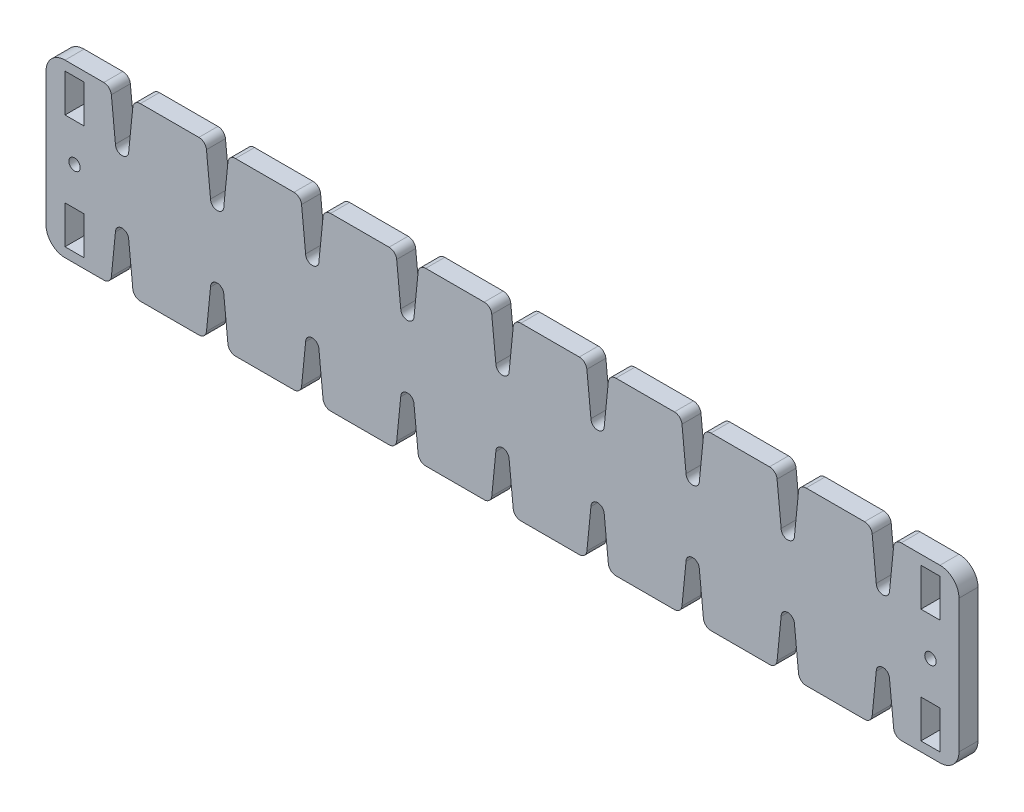
from build123d import *

# Parameters (mm, degrees)
SKETCH1_W           = 240
SKETCH1_H           = 45
SKETCH1_R           = 1.5
SKETCH1_W_2         = 5
SKETCH1_H_2         = 10
BOSS_EXTRUDE1_DEPTH = 5
CUT_EXTRUDE1_DEPTH  = 5
FILLET1_R           = 2
CONG_1_R            = 5


with BuildPart() as part:
    # Sketch1 → Boss-Extrude1 (new body)
    with BuildSketch(Plane.XY):
        with Locations((34.186746988, 0)):
            Rectangle(SKETCH1_W, SKETCH1_H)
        with Locations((-78.313253012, 0)):
            Circle(SKETCH1_R, mode=Mode.SUBTRACT)
        with Locations(Location((146.686746988, 0, 0), (0, 0, 180))):
            Circle(SKETCH1_R, mode=Mode.SUBTRACT)
        with Locations((-78.313253012, -15)):
            Rectangle(SKETCH1_W_2, SKETCH1_H_2, mode=Mode.SUBTRACT)
        with Locations((-78.313253012, 15)):
            Rectangle(SKETCH1_W_2, SKETCH1_H_2, mode=Mode.SUBTRACT)
        with Locations((146.686746988, -15)):
            Rectangle(SKETCH1_W_2, SKETCH1_H_2, mode=Mode.SUBTRACT)
        with Locations((146.686746988, 15)):
            Rectangle(SKETCH1_W_2, SKETCH1_H_2, mode=Mode.SUBTRACT)
    extrude(amount=BOSS_EXTRUDE1_DEPTH)

    # Sketch2 → Cut-Extrude1 (cut)
    with BuildSketch(Plane.XY.offset(5)):
        with BuildLine():
            Line((-68.813253012, 22.5), (-62.813253012, 22.5))
            Line((-62.813253012, 22.5), (-64.063253012, 10))
            ThreePointArc((-64.063253012, 10), (-65.813253012, 8.25), (-67.563253012, 10))
            Line((-67.563253012, 10), (-68.813253012, 22.5))
        make_face()
        with BuildLine():
            Line((-43.813253012, 22.5), (-37.813253012, 22.5))
            Line((-37.813253012, 22.5), (-39.063253012, 10))
            ThreePointArc((-39.063253012, 10), (-40.813253012, 8.25), (-42.563253012, 10))
            Line((-42.563253012, 10), (-43.813253012, 22.5))
        make_face()
        with BuildLine():
            Line((-18.813253012, 22.5), (-12.813253012, 22.5))
            Line((-12.813253012, 22.5), (-14.063253012, 10))
            ThreePointArc((-14.063253012, 10), (-15.813253012, 8.25), (-17.563253012, 10))
            Line((-17.563253012, 10), (-18.813253012, 22.5))
        make_face()
        with BuildLine():
            Line((6.186746988, 22.5), (12.186746988, 22.5))
            Line((12.186746988, 22.5), (10.936746988, 10))
            ThreePointArc((10.936746988, 10), (9.186746988, 8.25), (7.436746988, 10))
            Line((7.436746988, 10), (6.186746988, 22.5))
        make_face()
        with BuildLine():
            Line((31.186746988, 22.5), (37.186746988, 22.5))
            Line((37.186746988, 22.5), (35.936746988, 10))
            ThreePointArc((35.936746988, 10), (34.186746988, 8.25), (32.436746988, 10))
            Line((32.436746988, 10), (31.186746988, 22.5))
        make_face()
        with BuildLine():
            Line((56.186746988, 22.5), (62.186746988, 22.5))
            Line((62.186746988, 22.5), (60.936746988, 10))
            ThreePointArc((60.936746988, 10), (59.186746988, 8.25), (57.436746988, 10))
            Line((57.436746988, 10), (56.186746988, 22.5))
        make_face()
        with BuildLine():
            Line((81.186746988, 22.5), (87.186746988, 22.5))
            Line((87.186746988, 22.5), (85.936746988, 10))
            ThreePointArc((85.936746988, 10), (84.186746988, 8.25), (82.436746988, 10))
            Line((82.436746988, 10), (81.186746988, 22.5))
        make_face()
        with BuildLine():
            Line((106.186746988, 22.5), (112.186746988, 22.5))
            Line((112.186746988, 22.5), (110.936746988, 10))
            ThreePointArc((110.936746988, 10), (109.186746988, 8.25), (107.436746988, 10))
            Line((107.436746988, 10), (106.186746988, 22.5))
        make_face()
        with BuildLine():
            Line((131.186746988, 22.5), (137.186746988, 22.5))
            Line((137.186746988, 22.5), (135.936746988, 10))
            ThreePointArc((135.936746988, 10), (134.186746988, 8.25), (132.436746988, 10))
            Line((132.436746988, 10), (131.186746988, 22.5))
        make_face()
        with BuildLine():
            Line((137.186746988, -22.5), (135.936746988, -10))
            ThreePointArc((135.936746988, -10), (134.186746988, -8.25), (132.436746988, -10))
            Line((132.436746988, -10), (131.186746988, -22.5))
            Line((131.186746988, -22.5), (137.186746988, -22.5))
        make_face()
        with BuildLine():
            Line((112.186746988, -22.5), (110.936746988, -10))
            ThreePointArc((110.936746988, -10), (109.186746988, -8.25), (107.436746988, -10))
            Line((107.436746988, -10), (106.186746988, -22.5))
            Line((106.186746988, -22.5), (112.186746988, -22.5))
        make_face()
        with BuildLine():
            Line((87.186746988, -22.5), (85.936746988, -10))
            ThreePointArc((85.936746988, -10), (84.186746988, -8.25), (82.436746988, -10))
            Line((82.436746988, -10), (81.186746988, -22.5))
            Line((81.186746988, -22.5), (87.186746988, -22.5))
        make_face()
        with BuildLine():
            Line((62.186746988, -22.5), (60.936746988, -10))
            ThreePointArc((60.936746988, -10), (59.186746988, -8.25), (57.436746988, -10))
            Line((57.436746988, -10), (56.186746988, -22.5))
            Line((56.186746988, -22.5), (62.186746988, -22.5))
        make_face()
        with BuildLine():
            Line((37.186746988, -22.5), (35.936746988, -10))
            ThreePointArc((35.936746988, -10), (34.186746988, -8.25), (32.436746988, -10))
            Line((32.436746988, -10), (31.186746988, -22.5))
            Line((31.186746988, -22.5), (37.186746988, -22.5))
        make_face()
        with BuildLine():
            Line((12.186746988, -22.5), (10.936746988, -10))
            ThreePointArc((10.936746988, -10), (9.186746988, -8.25), (7.436746988, -10))
            Line((7.436746988, -10), (6.186746988, -22.5))
            Line((6.186746988, -22.5), (12.186746988, -22.5))
        make_face()
        with BuildLine():
            Line((-12.813253012, -22.5), (-14.063253012, -10))
            ThreePointArc((-14.063253012, -10), (-15.813253012, -8.25), (-17.563253012, -10))
            Line((-17.563253012, -10), (-18.813253012, -22.5))
            Line((-18.813253012, -22.5), (-12.813253012, -22.5))
        make_face()
        with BuildLine():
            Line((-37.813253012, -22.5), (-39.063253012, -10))
            ThreePointArc((-39.063253012, -10), (-40.813253012, -8.25), (-42.563253012, -10))
            Line((-42.563253012, -10), (-43.813253012, -22.5))
            Line((-43.813253012, -22.5), (-37.813253012, -22.5))
        make_face()
        with BuildLine():
            Line((-62.813253012, -22.5), (-64.063253012, -10))
            ThreePointArc((-64.063253012, -10), (-65.813253012, -8.25), (-67.563253012, -10))
            Line((-67.563253012, -10), (-68.813253012, -22.5))
            Line((-68.813253012, -22.5), (-62.813253012, -22.5))
        make_face()
    extrude(amount=-CUT_EXTRUDE1_DEPTH, mode=Mode.SUBTRACT)

    # Fillet1
    fillet1_edges = [part.edges().sort_by_distance(p)[0] for p in [
        (-62.813253012, -22.5, 2.5),
        (-68.813253012, -22.5, 2.5),
        (-37.813253012, -22.5, 2.5),
        (-43.813253012, -22.5, 2.5),
        (-12.813253012, -22.5, 2.5),
        (-18.813253012, -22.5, 2.5),
        (12.186746988, -22.5, 2.5),
        (6.186746988, -22.5, 2.5),
        (37.186746988, -22.5, 2.5),
        (31.186746988, -22.5, 2.5),
        (62.186746988, -22.5, 2.5),
        (56.186746988, -22.5, 2.5),
        (87.186746988, -22.5, 2.5),
        (81.186746988, -22.5, 2.5),
        (112.186746988, -22.5, 2.5),
        (106.186746988, -22.5, 2.5),
        (137.186746988, -22.5, 2.5),
        (131.186746988, -22.5, 2.5),
        (131.186746988, 22.5, 2.5),
        (137.186746988, 22.5, 2.5),
        (106.186746988, 22.5, 2.5),
        (112.186746988, 22.5, 2.5),
        (81.186746988, 22.5, 2.5),
        (87.186746988, 22.5, 2.5),
        (56.186746988, 22.5, 2.5),
        (62.186746988, 22.5, 2.5),
        (31.186746988, 22.5, 2.5),
        (37.186746988, 22.5, 2.5),
        (6.186746988, 22.5, 2.5),
        (12.186746988, 22.5, 2.5),
        (-18.813253012, 22.5, 2.5),
        (-12.813253012, 22.5, 2.5),
        (-43.813253012, 22.5, 2.5),
        (-37.813253012, 22.5, 2.5),
        (-68.813253012, 22.5, 2.5),
        (-62.813253012, 22.5, 2.5),
    ]]
    fillet(fillet1_edges, radius=FILLET1_R)

    # Congé1
    cong_1_edges = [part.edges().sort_by_distance(p)[0] for p in [
        (-85.813253012, 22.5, 2.5),
        (154.186746988, 22.5, 2.5),
        (154.186746988, -22.5, 2.5),
        (-85.813253012, -22.5, 2.5),
    ]]
    fillet(cong_1_edges, radius=CONG_1_R)


solid = part.part
